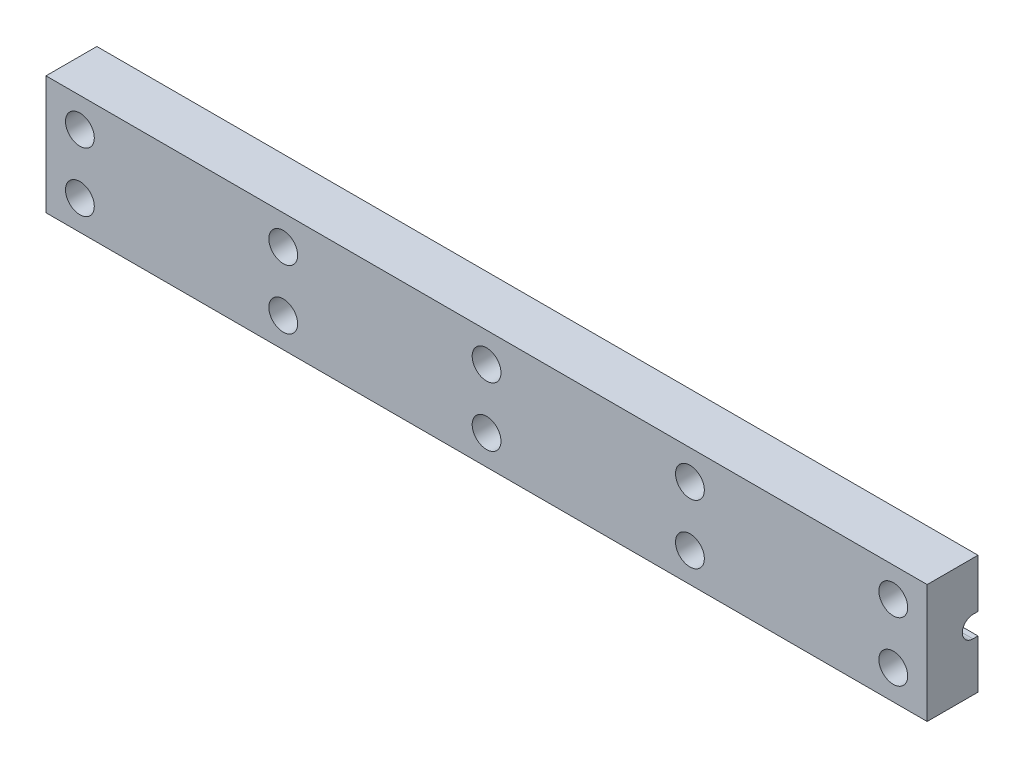
from build123d import *

# Parameters (mm, degrees)
BOSS_EXTRUDE1_DEPTH      = 60
BOSS_EXTRUDE1_DEPTH_BACK = 20
SKETCH2_R                = 1.7
CUT_EXTRUDE1_DEPTH       = 10
BOSS_EXTRUDE2_START      = 24
BOSS_EXTRUDE2_DEPTH      = 24
SKETCH4_R                = 1.7
CUT_EXTRUDE2_DEPTH       = 24


with BuildPart() as part:
    # Sketch1 → Boss-Extrude1 (new, two sides: drawn at the far end of the back side and taken through both)
    with BuildSketch(Plane(origin=(190.645148, 0, 0), x_dir=(0, 0, -1), z_dir=(1, 0, 0)).offset(-BOSS_EXTRUDE1_DEPTH_BACK)):
        with BuildLine():
            Line((-246.970904961, 208.163538159), (-246.970904961, 205.163538159))
            Line((-246.970904961, 205.163538159), (-246.970904961, 197.163538159))
            Line((-246.970904961, 197.163538159), (-246.970904961, 194.163538159))
            Line((-246.970904961, 194.163538159), (-240.970904961, 194.163538159))
            Line((-240.970904961, 194.163538159), (-240.970904961, 197.163538159))
            Line((-240.970904961, 197.163538159), (-240.970904961, 199.913538158))
            Line((-240.970904961, 199.913538158), (-241.570904961, 199.913538158))
            ThreePointArc((-241.570904961, 199.913538158), (-242.820904961, 201.163538162), (-241.570904955, 202.413538158))
            Line((-241.570904955, 202.413538158), (-240.970904961, 202.413538158))
            Line((-240.970904961, 202.413538158), (-240.970904961, 205.163538159))
            Line((-240.970904961, 205.163538159), (-240.970904961, 208.163538159))
            Line((-240.970904961, 208.163538159), (-246.970904961, 208.163538159))
        make_face()
    extrude(amount=BOSS_EXTRUDE1_DEPTH + BOSS_EXTRUDE1_DEPTH_BACK)

    # Sketch2 → Cut-Extrude1 (cut)
    with BuildSketch(Plane.XY.offset(246.970904961)):
        with Locations((246.645148, 197.663538159)):
            Circle(SKETCH2_R)
        with Locations((198.645148, 197.663538159)):
            Circle(SKETCH2_R)
        with Locations((174.645148, 197.663538159)):
            Circle(SKETCH2_R)
        with Locations((222.645148, 197.663538159)):
            Circle(SKETCH2_R)
        with Locations((174.645148, 204.663538159)):
            Circle(SKETCH2_R)
        with Locations((198.645148, 204.663538159)):
            Circle(SKETCH2_R)
        with Locations((222.645148, 204.663538159)):
            Circle(SKETCH2_R)
        with Locations((246.645148, 204.663538159)):
            Circle(SKETCH2_R)
    extrude(amount=-CUT_EXTRUDE1_DEPTH, mode=Mode.SUBTRACT)

    # Sketch3 → Boss-Extrude2 (add)
    with BuildSketch(Plane.ZY.offset(-170.645148).offset(BOSS_EXTRUDE2_START)):
        with BuildLine():
            Line((246.970904961, 208.163538159), (240.970904961, 208.163538159))
            Line((240.970904961, 208.163538159), (240.970904961, 202.413538158))
            Line((240.970904961, 202.413538158), (241.570904955, 202.413538158))
            ThreePointArc((241.570904955, 202.413538158), (242.820904961, 201.163538162), (241.570904961, 199.913538158))
            Line((241.570904961, 199.913538158), (240.970904961, 199.913538158))
            Line((240.970904961, 199.913538158), (240.970904961, 194.163538159))
            Line((240.970904961, 194.163538159), (246.970904961, 194.163538159))
            Line((246.970904961, 194.163538159), (246.970904961, 208.163538159))
        make_face()
    extrude(amount=-BOSS_EXTRUDE2_DEPTH)

    # Sketch4 → Cut-Extrude2 (cut)
    with BuildSketch(Plane.XY.offset(246.970904961)):
        with Locations((174.645148, 204.663538159)):
            Circle(SKETCH4_R)
        with Locations((174.645148, 197.663538159)):
            Circle(SKETCH4_R)
        with Locations((150.645148, 197.663538159)):
            Circle(SKETCH4_R)
        with Locations((150.645148, 204.663538159)):
            Circle(SKETCH4_R)
    extrude(amount=-CUT_EXTRUDE2_DEPTH, mode=Mode.SUBTRACT)


solid = part.part
